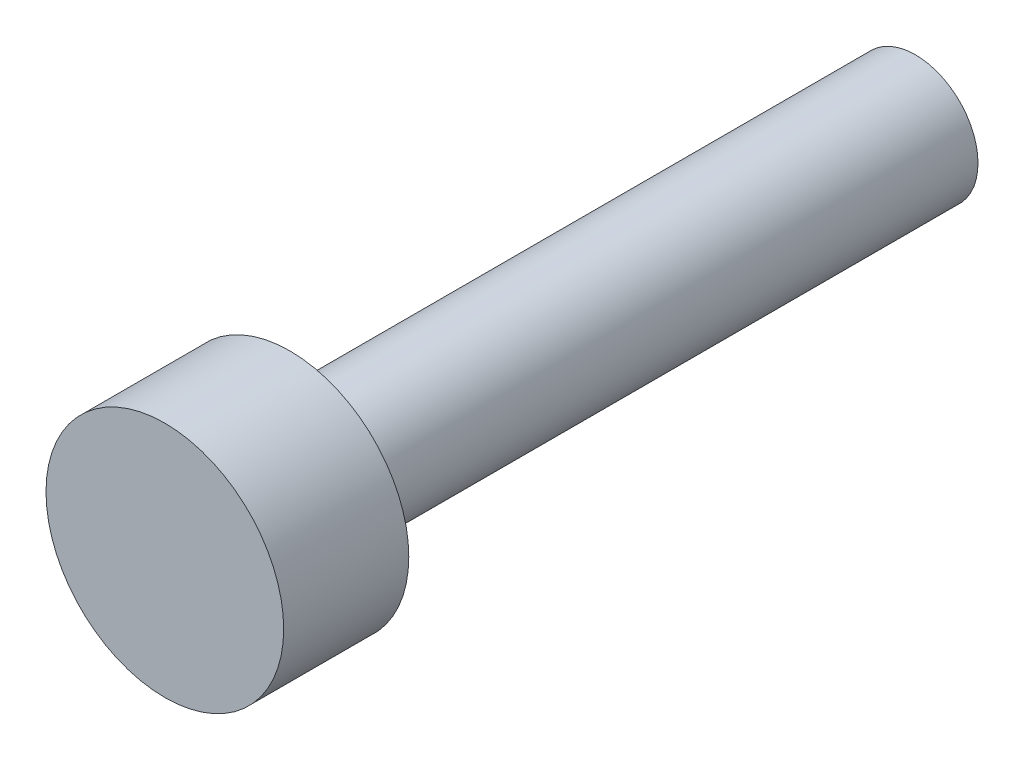
from build123d import *

# Parameters (mm, degrees)
THREAD_ENVELOPE_START = -10
SKETCH1_R             = 1
THREAD_ENVELOPE_DEPTH = 10
SKETCH2_R             = 1.9
HEAD_ENVELOPE_DEPTH   = 2


with BuildPart() as part:
    # Sketch1 → Thread_Envelope (new body)
    with BuildSketch(Plane.XY.offset(THREAD_ENVELOPE_START)):
        Circle(SKETCH1_R)
    extrude(amount=THREAD_ENVELOPE_DEPTH)

    # Sketch2 → Head_Envelope (add)
    with BuildSketch(Plane.XY):
        Circle(SKETCH2_R)
    extrude(amount=HEAD_ENVELOPE_DEPTH)


solid = part.part
